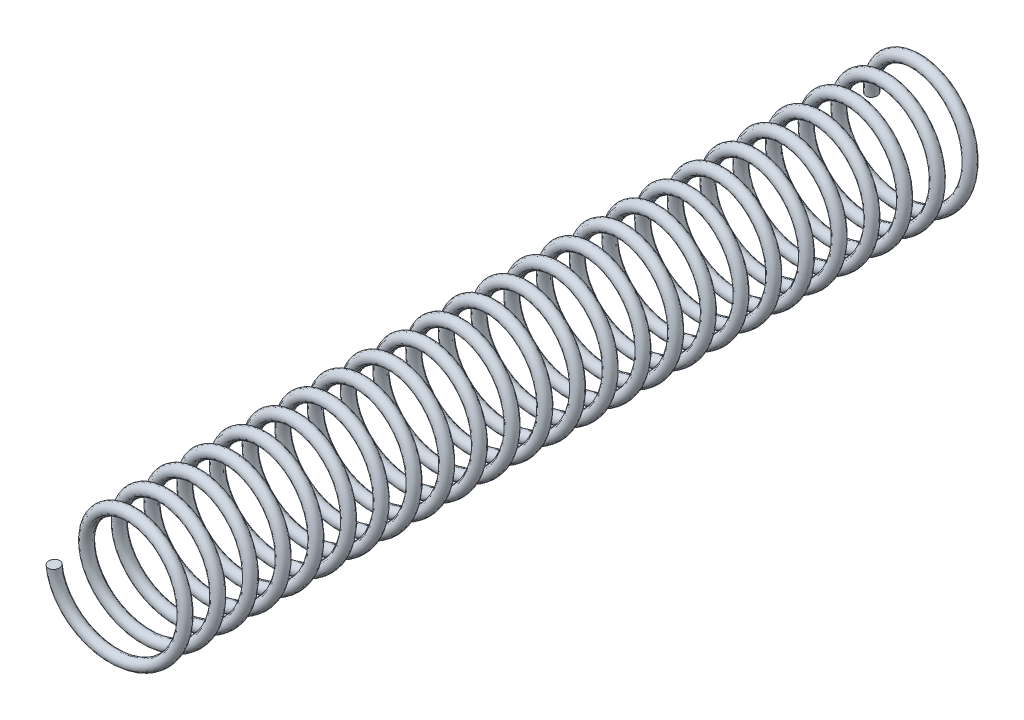
from build123d import *

# Parameters (mm, degrees)
SWEEP_1_PITCH       = 2
SWEEP_1_HEIGHT      = 50
SWEEP_1_RADIUS      = 3.5
SWEEP_1_START_ANGLE = -180
SWEEP_1_PROFILE_R   = 0.35


with BuildPart() as part:
    # По траектории1: sweep along a helix
    with BuildLine() as sweep_1_path:
        add(Helix(SWEEP_1_PITCH, SWEEP_1_HEIGHT, SWEEP_1_RADIUS, center=(0, 0, 0), direction=(0, 0, 1), lefthand=True, mode=Mode.PRIVATE).rotate(Axis((0, 0, 0), (0, 0, 1)), SWEEP_1_START_ANGLE))
    # По траектории1 profile (on start of the path) → По траектории1 (sweep)
    with BuildSketch(Plane(origin=(-3.5, 0, 0), x_dir=(0, -0.0905718877568337, 0.9958899201960845), z_dir=(2.4794570450348588e-14, 0.9958899201960845, 0.0905718877568337))):
        Circle(SWEEP_1_PROFILE_R)
    sweep(path=sweep_1_path.line, is_frenet=True)


solid = part.part
